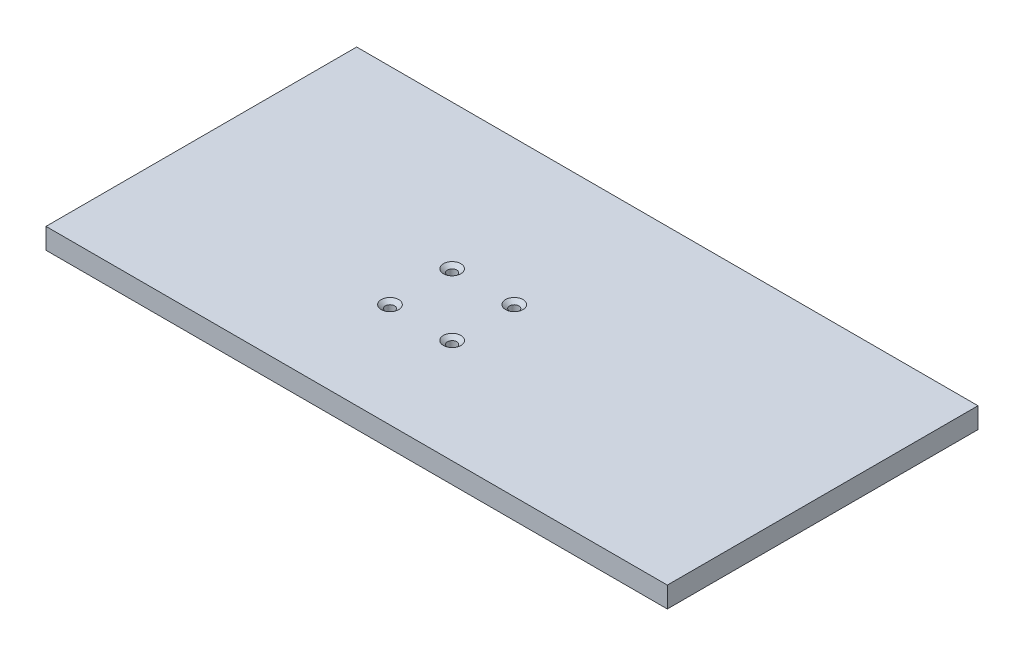
from build123d import *

# Parameters (mm, degrees)
SKETCH1_W                                         = 300
SKETCH1_H                                         = 150
BOSS_EXTRUDE1_DEPTH                               = 10
CSK_FOR_8_FLAT_HEAD_MACHINE_SCREW_100_D           = 4.4958
CSK_FOR_8_FLAT_HEAD_MACHINE_SCREW_100_CSINK_D     = 8.4328
CSK_FOR_8_FLAT_HEAD_MACHINE_SCREW_100_CSINK_ANGLE = 100


with BuildPart() as part:
    # Sketch1 → Boss-Extrude1 (new body)
    with BuildSketch(Plane(origin=(0, 0, 0), x_dir=(1, 0, 0), z_dir=(0, 1, 0))):
        Rectangle(SKETCH1_W, SKETCH1_H)
    extrude(amount=BOSS_EXTRUDE1_DEPTH)

    # CSK for #8 Flat Head Machine Screw (100)1 (through all)
    with Locations(Plane(origin=(0, 10, 0), x_dir=(1, 0, 0), z_dir=(0, 1, 0))):
        with Locations((-4.244224193, 5.335070952), (-4.244224193, -24.664929048), (-34.244224193, -24.664929048), (-34.244224193, 5.335070952)):
            CounterSinkHole(CSK_FOR_8_FLAT_HEAD_MACHINE_SCREW_100_D / 2, CSK_FOR_8_FLAT_HEAD_MACHINE_SCREW_100_CSINK_D / 2, counter_sink_angle=CSK_FOR_8_FLAT_HEAD_MACHINE_SCREW_100_CSINK_ANGLE)


solid = part.part
